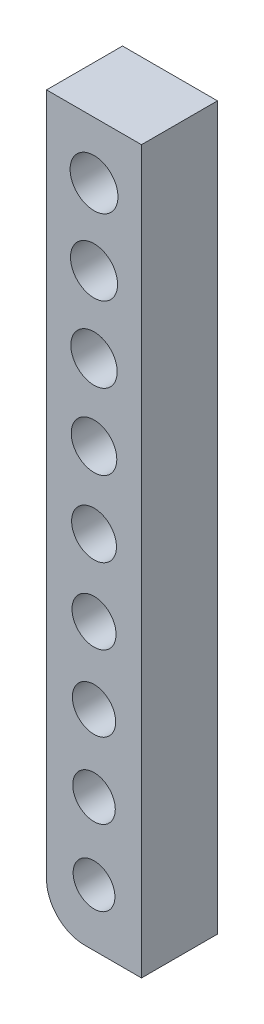
from build123d import *

# Parameters (mm, degrees)
SKETCH1_W           = 48.26
SKETCH1_H           = 6.35
SKETCH1_R           = 1.397
SKETCH1_R_2         = 1.4224
SKETCH1_R_3         = 1.4478
SKETCH1_R_4         = 1.4732
SKETCH1_R_5         = 1.4986
SKETCH1_R_6         = 1.524
SKETCH1_R_7         = 1.5494
SKETCH1_R_8         = 1.5748
SKETCH1_R_9         = 1.6002
BOSS_EXTRUDE1_DEPTH = 5.08
FILLET1_R           = 2.54


with BuildPart() as part:
    # Sketch1 → Boss-Extrude1 (new body)
    with BuildSketch(Plane(origin=(0, 0, 0), x_dir=(0, 1, 0), z_dir=(0, 0, 1))):
        with Locations((24.13, 3.175)):
            Rectangle(SKETCH1_W, SKETCH1_H)
        with Locations(Location((3.81, 3.175, 0), (0, 0, 270))):
            Circle(SKETCH1_R, mode=Mode.SUBTRACT)
        with Locations(Location((8.89, 3.175, 0), (0, 0, 270))):
            Circle(SKETCH1_R_2, mode=Mode.SUBTRACT)
        with Locations(Location((13.97, 3.175, 0), (0, 0, 270))):
            Circle(SKETCH1_R_3, mode=Mode.SUBTRACT)
        with Locations(Location((19.05, 3.175, 0), (0, 0, 270))):
            Circle(SKETCH1_R_4, mode=Mode.SUBTRACT)
        with Locations(Location((24.13, 3.175, 0), (0, 0, 270))):
            Circle(SKETCH1_R_5, mode=Mode.SUBTRACT)
        with Locations(Location((29.21, 3.175, 0), (0, 0, 270))):
            Circle(SKETCH1_R_6, mode=Mode.SUBTRACT)
        with Locations(Location((34.29, 3.175, 0), (0, 0, 270))):
            Circle(SKETCH1_R_7, mode=Mode.SUBTRACT)
        with Locations(Location((39.37, 3.175, 0), (0, 0, 270))):
            Circle(SKETCH1_R_8, mode=Mode.SUBTRACT)
        with Locations(Location((44.45, 3.175, 0), (0, 0, 270))):
            Circle(SKETCH1_R_9, mode=Mode.SUBTRACT)
    extrude(amount=BOSS_EXTRUDE1_DEPTH)

    # Fillet1
    fillet1_edges = [part.edges().sort_by_distance(p)[0] for p in [
        (-6.35, 0, 2.54),
    ]]
    fillet(fillet1_edges, radius=FILLET1_R)


solid = part.part
